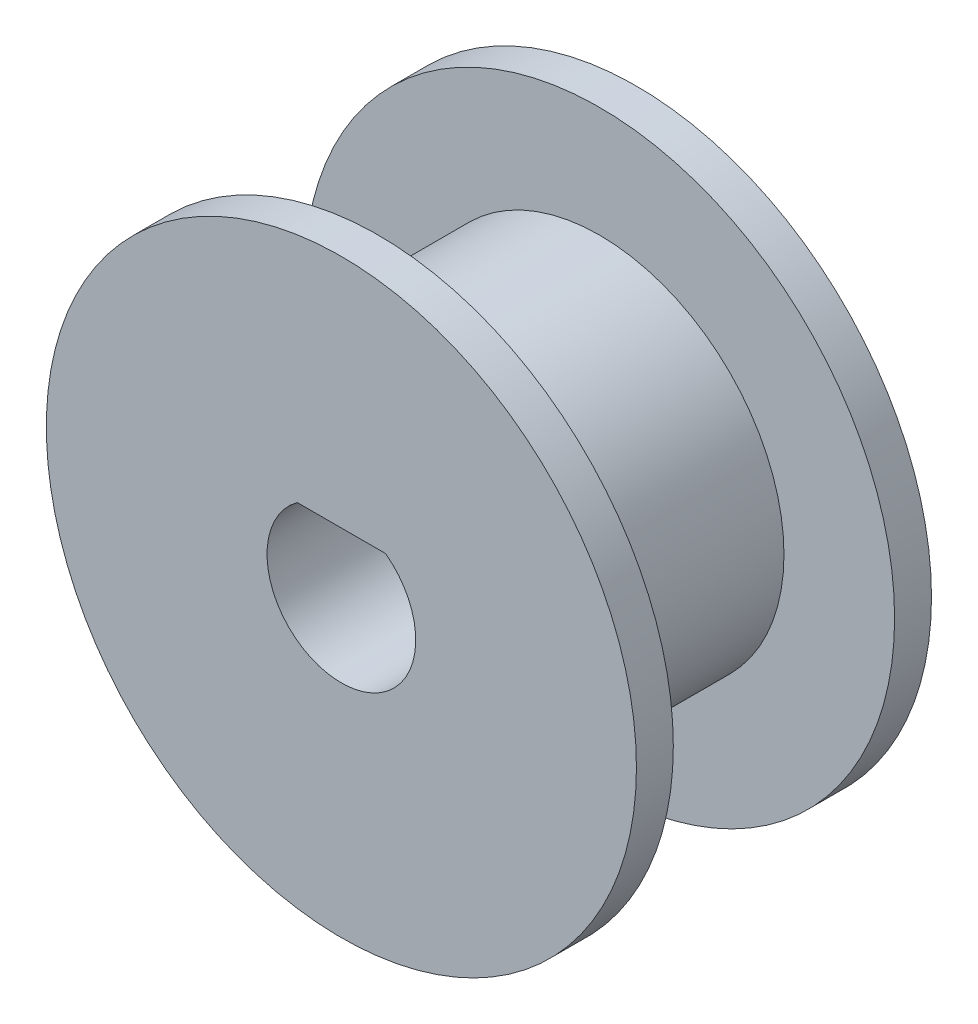
from build123d import *

# Parameters (mm, degrees)
SKETCH1_R               = 12.7
BASE_VOLUME_DEPTH       = 6.35
SKETCH2_OUTSIDE_W       = 35.02
SKETCH2_OUTSIDE_H       = 35.02
SKETCH2_OUTSIDE_R       = 7.9375
ENCAVURE_DEPTH          = 4.7625
TROU_SHAFT_D_DEPTH      = 20.05
TROU_SHAFT_D_DEPTH_BACK = 20.05


with BuildPart() as part:
    # Sketch1 → base_volume (new, symmetric)
    with BuildSketch(Plane.XY):
        Circle(SKETCH1_R)
    extrude(amount=BASE_VOLUME_DEPTH, both=True)

    # Sketch2 outside → encavure (cut, symmetric)
    with BuildSketch(Plane.XY):
        Rectangle(SKETCH2_OUTSIDE_W, SKETCH2_OUTSIDE_H)
        Circle(SKETCH2_OUTSIDE_R, mode=Mode.SUBTRACT)
    extrude(amount=ENCAVURE_DEPTH, both=True, mode=Mode.SUBTRACT)

    # Sketch3 → trou_shaft_D (cut, two sides: drawn at the far end of the back side and taken through both)
    with BuildSketch(Plane.XY.offset(-TROU_SHAFT_D_DEPTH_BACK)):
        with BuildLine():
            Line((-1.9, 2.574878638), (1.9, 2.574878638))
            ThreePointArc((1.9, 2.574878638), (0, -3.2), (-1.9, 2.574878638))
        make_face()
    extrude(amount=TROU_SHAFT_D_DEPTH + TROU_SHAFT_D_DEPTH_BACK, mode=Mode.SUBTRACT)


solid = part.part
